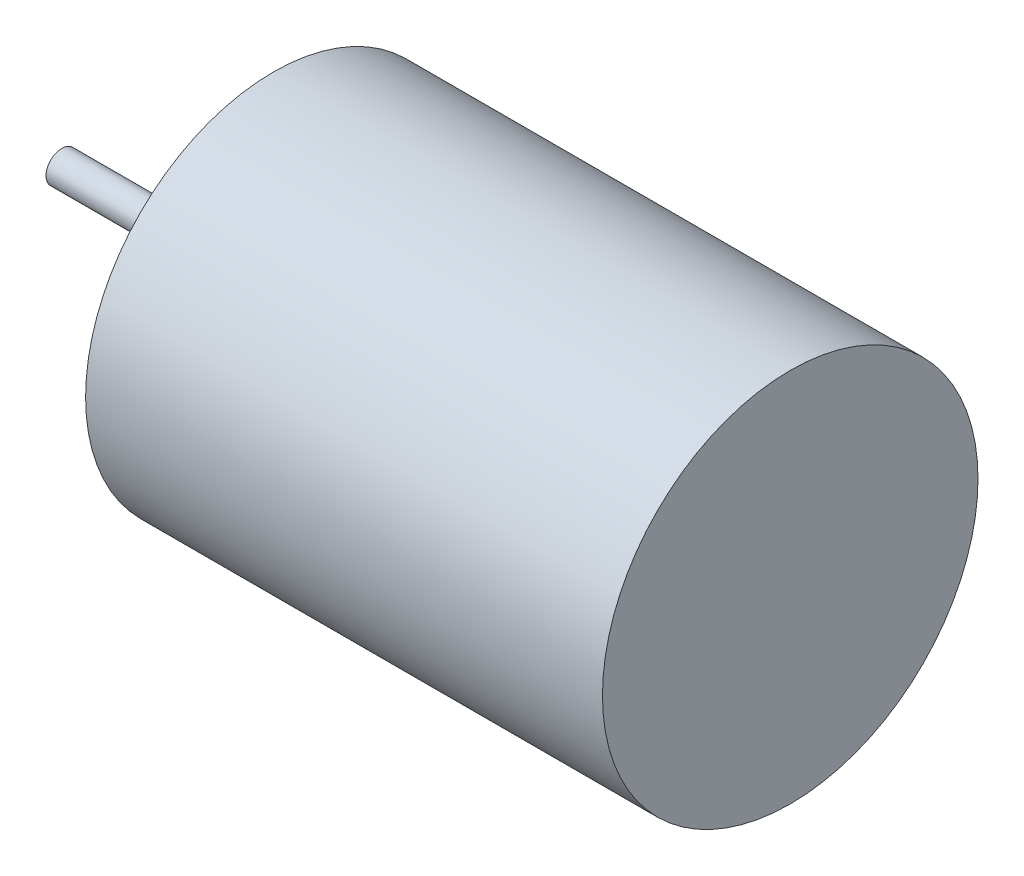
from build123d import *


with BuildPart() as part:
    # Sketch1 → Revolve1 (revolve)
    with BuildSketch(Plane.XY, mode=Mode.PRIVATE) as revolve1_sk:
        Polygon((0, 0), (0, 1.15), (13, 1.15), (13, 4.95), (15.5, 4.95), (15.5, 13.75), (53.35, 13.75), (53.35, 4.752190947), (53.35, 0), (38.956228045, 0), align=None)
    revolve(revolve1_sk.sketch.rotate(Axis((-15.21540166, 0, 0), (1, 0, 0)), 90), axis=Axis((-15.21540166, 0, 0), (1, 0, 0)))


solid = part.part
